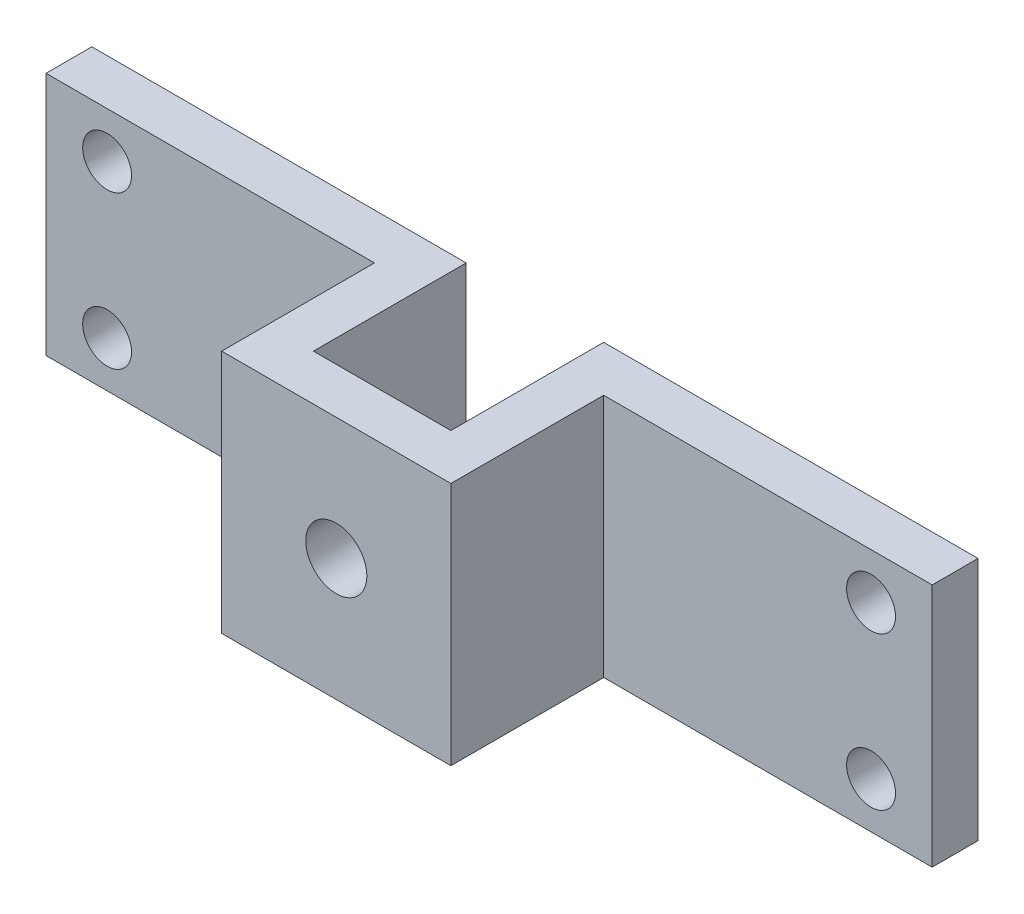
from build123d import *

# Parameters (mm, degrees)
EXTRUDE_1_DEPTH     = 16
SKETCH_2_R          = 2
SKETCH_2_R_2        = 1.59996579
CUT_EXTRUDE_1_DEPTH = 16


with BuildPart() as part:
    # 草图1 → 凸台-拉伸1 (new body)
    with BuildSketch(Plane(origin=(0, 0, 0), x_dir=(1, 0, 0), z_dir=(0, 1, 0))):
        Polygon((0, 0), (24.5, 0), (24.5, -10), (33.5, -10), (33.5, 0), (58, 0), (58, -3), (36.5, -3), (36.5, -13), (21.5, -13), (21.5, -3), (0, -3), align=None)
    extrude(amount=EXTRUDE_1_DEPTH)

    # 草图2 → 切除-拉伸1 (cut)
    with BuildSketch(Plane.XY.offset(13)):
        with Locations((29, 8)):
            Circle(SKETCH_2_R)
        with Locations((4, 13)):
            Circle(SKETCH_2_R_2)
        with Locations((4, 3)):
            Circle(SKETCH_2_R_2)
        with Locations((54, 13)):
            Circle(SKETCH_2_R_2)
        with Locations((54, 3)):
            Circle(SKETCH_2_R_2)
    extrude(amount=-CUT_EXTRUDE_1_DEPTH, mode=Mode.SUBTRACT)


solid = part.part
